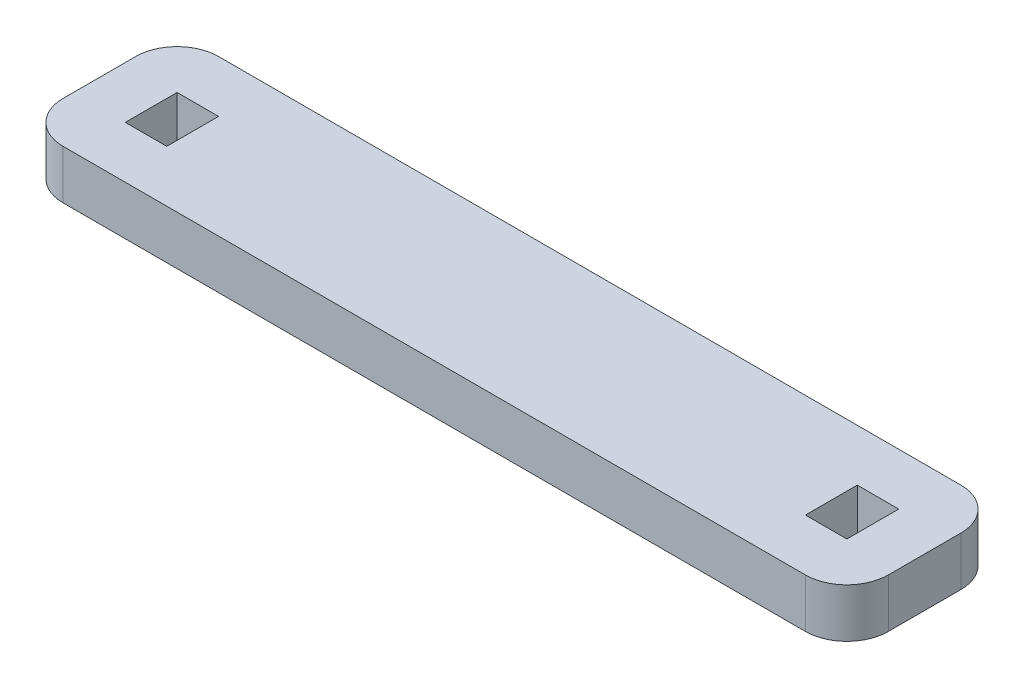
from build123d import *

# Parameters (mm, degrees)
SKETCH1_W           = 50.546
SKETCH1_H           = 9.525
SKETCH1_W_2         = 2.54
SKETCH1_H_2         = 3.175
BOSS_EXTRUDE1_DEPTH = 1.5
FILLET1_R           = 2.54


with BuildPart() as part:
    # Sketch1 → Boss-Extrude1 (new, symmetric)
    with BuildSketch(Plane(origin=(0, 0, 0), x_dir=(1, 0, 0), z_dir=(0, 1, 0))):
        Rectangle(SKETCH1_W, SKETCH1_H)
        with Locations((-20.828, 0)):
            Rectangle(SKETCH1_W_2, SKETCH1_H_2, mode=Mode.SUBTRACT)
        with Locations((20.828, 0)):
            Rectangle(SKETCH1_W_2, SKETCH1_H_2, mode=Mode.SUBTRACT)
    extrude(amount=BOSS_EXTRUDE1_DEPTH, both=True)

    # Fillet1
    fillet1_edges = [part.edges().sort_by_distance(p)[0] for p in [
        (-25.273, 0, -4.7625),
        (25.273, 0, -4.7625),
        (25.273, 0, 4.7625),
        (-25.273, 0, 4.7625),
    ]]
    fillet(fillet1_edges, radius=FILLET1_R)


solid = part.part
